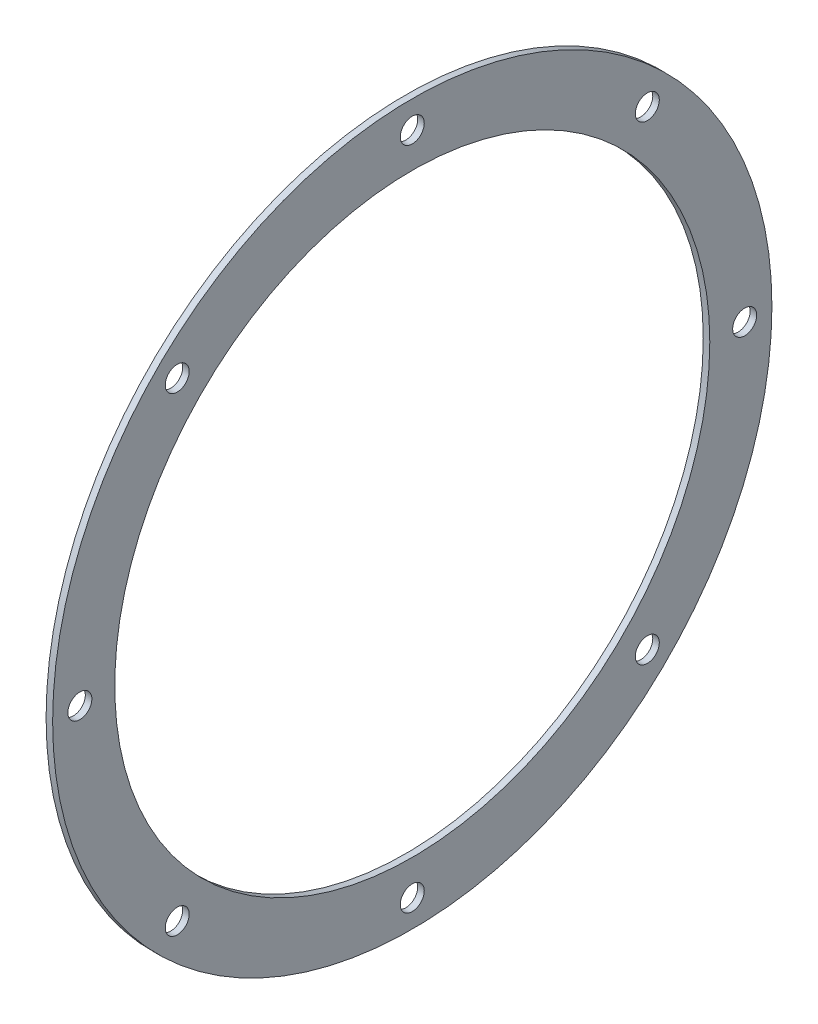
from build123d import *

# Parameters (mm, degrees)
SKIZZE2_R                       = 165
SKIZZE2_R_2                     = 136.5
AUFSATZ_LINEAR_AUSTRAGEN1_DEPTH = 3
DURCHGANGSLOCH_F_R_M101_D       = 11
KREISMUSTER1_COUNT              = 8


with BuildPart() as part:
    # Skizze2 → Aufsatz-Linear austragen1 (new body)
    with BuildSketch(Plane(origin=(0, 0, 0), x_dir=(0, 0, -1), z_dir=(1, 0, 0))):
        Circle(SKIZZE2_R)
        Circle(SKIZZE2_R_2, mode=Mode.SUBTRACT)
    extrude(amount=-AUFSATZ_LINEAR_AUSTRAGEN1_DEPTH)

    # Durchgangsloch für M101 (through all)
    with Locations(Plane(origin=(0, -26.503392929, -77.586576954), x_dir=(0, 0, -1), z_dir=(1, 0, 0))):
        with Locations((-77.586576954, 179.003392929)):
            durchgangsloch_f_r_m101 = Hole(DURCHGANGSLOCH_F_R_M101_D / 2)

    # Kreismuster1: Durchgangsloch für M101 ×8 about axis
    kreismuster1_axis = Axis((0, 0, 0), (1, 0, 0))
    for i in range(1, KREISMUSTER1_COUNT):
        add(durchgangsloch_f_r_m101.rotate(kreismuster1_axis, i * 360 / KREISMUSTER1_COUNT), mode=Mode.SUBTRACT)


solid = part.part
